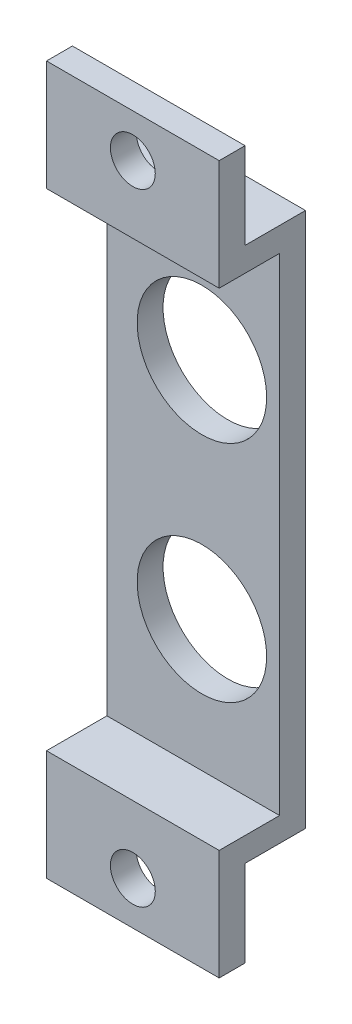
from build123d import *

# Parameters (mm, degrees)
SKETCH1_W             = 20
SKETCH1_H             = 10
SKETCH1_R             = 2.6
BOSS_EXTRUDE1_DEPTH   = 3
BOSS_EXTRUDE1_2_DEPTH = 3
SKETCH4_W             = 20
SKETCH4_H             = 62
SKETCH4_R             = 7.5
BOSS_EXTRUDE2_DEPTH   = 3
SKETCH5_W             = 20
SKETCH5_H             = 2.8
BOSS_EXTRUDE3_DEPTH   = 7


with BuildPart() as part:
    # Sketch1 → Boss-Extrude1 (new body)
    with BuildSketch(Plane.XY):
        with Locations((0, 36)):
            Rectangle(SKETCH1_W, SKETCH1_H)
        with Locations((0, 36)):
            Circle(SKETCH1_R, mode=Mode.SUBTRACT)
    extrude(amount=-BOSS_EXTRUDE1_DEPTH)



with BuildPart() as body_2:
    # Sketch1 → Boss-Extrude1 2 (new body)
    with BuildSketch(Plane.XY):
        with Locations((0, -36)):
            Rectangle(SKETCH1_W, SKETCH1_H)
        with Locations((0, -36)):
            Circle(SKETCH1_R, mode=Mode.SUBTRACT)
    extrude(amount=-BOSS_EXTRUDE1_2_DEPTH)


with BuildPart() as body_3:
    # Sketch4 → Boss-Extrude2 (new body)
    with BuildSketch(Plane.XY.offset(-7)):
        Rectangle(SKETCH4_W, SKETCH4_H)
        with Locations((1, 13)):
            Circle(SKETCH4_R, mode=Mode.SUBTRACT)
        with Locations((1, -13)):
            Circle(SKETCH4_R, mode=Mode.SUBTRACT)
    extrude(amount=-BOSS_EXTRUDE2_DEPTH)


with BuildPart() as part_1:
    add(part.part)

    add(body_2.part)  # Boss-Extrude3 merges body 2

    add(body_3.part)  # Boss-Extrude3 merges body 3
    # Sketch5 → Boss-Extrude3 (add)
    with BuildSketch(Plane.XY.offset(-7)):
        with Locations((0, 29.6)):
            Rectangle(SKETCH5_W, SKETCH5_H)
        with Locations((0, -29.6)):
            Rectangle(SKETCH5_W, SKETCH5_H)
    extrude(amount=BOSS_EXTRUDE3_DEPTH)


solid = part_1.part
